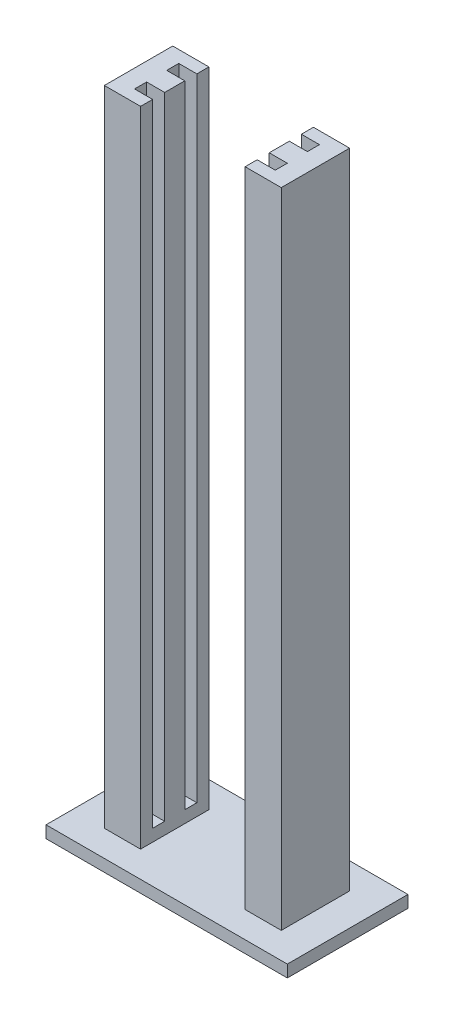
from build123d import *

# Parameters (mm, degrees)
SKETCH1_W           = 60
SKETCH1_H           = 30
BOSS_EXTRUDE1_DEPTH = 3
SKETCH2_W           = 9
SKETCH2_H           = 17
BOSS_EXTRUDE2_DEPTH = 160
SKETCH3_W           = 4.5
SKETCH3_H           = 3
CUT_EXTRUDE1_DEPTH  = 157


with BuildPart() as part:
    # Sketch1 → Boss-Extrude1 (new body)
    with BuildSketch(Plane(origin=(0, 0, 0), x_dir=(1, 0, 0), z_dir=(0, 1, 0))):
        Rectangle(SKETCH1_W, SKETCH1_H)
    extrude(amount=BOSS_EXTRUDE1_DEPTH)

    # Sketch2 → Boss-Extrude2 (add)
    with BuildSketch(Plane(origin=(0, 3, 0), x_dir=(1, 0, 0), z_dir=(0, 1, 0))):
        with Locations((17.5, 0)):
            Rectangle(SKETCH2_W, SKETCH2_H)
        with Locations((-17.5, 0)):
            Rectangle(SKETCH2_W, SKETCH2_H)
    extrude(amount=BOSS_EXTRUDE2_DEPTH)

    # Sketch3 → Cut-Extrude1 (cut)
    with BuildSketch(Plane(origin=(0, 163, 0), x_dir=(1, 0, 0), z_dir=(0, 1, 0))):
        with Locations((-15.25, 4)):
            Rectangle(SKETCH3_W, SKETCH3_H)
        with Locations((-15.25, -4)):
            Rectangle(SKETCH3_W, SKETCH3_H)
        with Locations((15.25, -4)):
            Rectangle(SKETCH3_W, SKETCH3_H)
        with Locations((15.25, 4)):
            Rectangle(SKETCH3_W, SKETCH3_H)
    extrude(amount=-CUT_EXTRUDE1_DEPTH, mode=Mode.SUBTRACT)


solid = part.part
